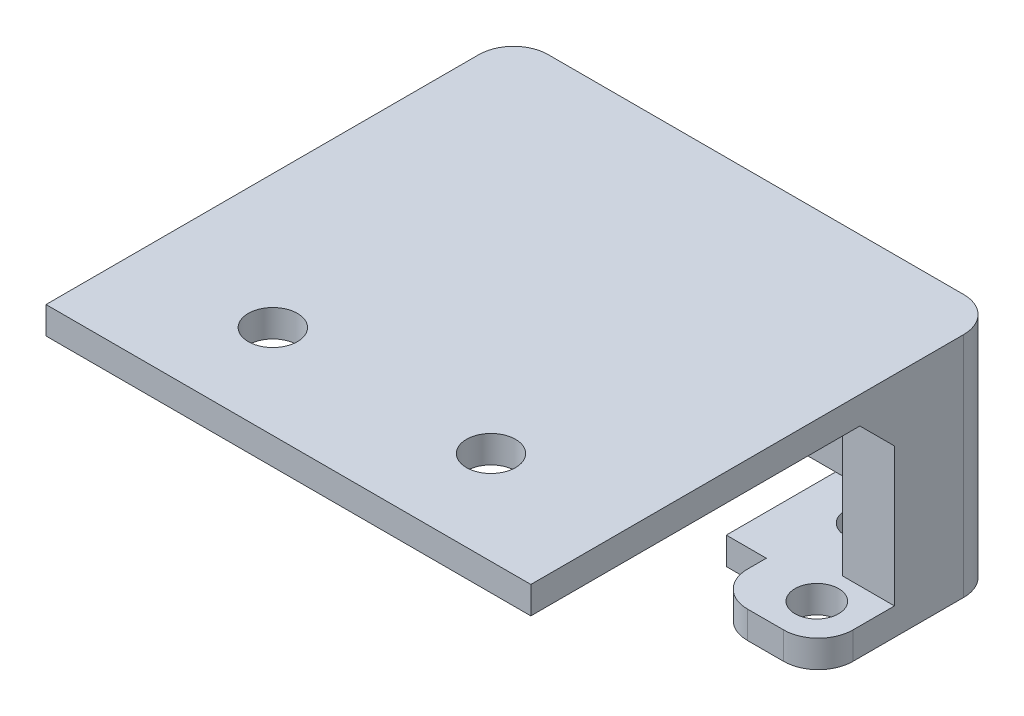
from build123d import *

# Parameters (mm, degrees)
SKETCH2_R             = 1.6
BOSS_EXTRUDE1_DEPTH   = 2
BOSS_EXTRUDE1_2_DEPTH = 2
BOSS_EXTRUDE2_DEPTH   = 12.7
SKETCH4_R             = 1.8
BOSS_EXTRUDE3_DEPTH   = 2
CHAMFER1_SIZE         = 2.54


with BuildPart() as part:
    # Sketch2 → Boss-Extrude1 (new body)
    with BuildSketch(Plane(origin=(0, 84.355025863, 0), x_dir=(1, 0, 0), z_dir=(0, 1, 0))):
        with BuildLine():
            Line((86.165130669, -169.940155685), (88.815130669, -169.940155685))
            ThreePointArc((88.815130669, -169.940155685), (90.611181893, -169.196206909), (91.355130669, -167.400155685))
            Line((91.355130669, -167.400155685), (91.355130669, -166.020155685))
            Line((91.355130669, -166.020155685), (94.293130669, -166.020155685))
            Line((94.293130669, -166.020155685), (94.293130669, -163.082155685))
            Line((94.293130669, -163.082155685), (94.293130669, -156.732155685))
            Line((94.293130669, -156.732155685), (86.165130669, -156.732155685))
            ThreePointArc((86.165130669, -156.732155685), (84.369079444, -157.47610446), (83.625130669, -159.272155685))
            Line((83.625130669, -159.272155685), (83.625130669, -167.400155685))
            ThreePointArc((83.625130669, -167.400155685), (84.369079444, -169.196206909), (86.165130669, -169.940155685))
        make_face()
        with Locations(Location((86.773356517, -166.898975693, 0), (0, 0, 270))):
            Circle(SKETCH2_R, mode=Mode.SUBTRACT)
        with Locations(Location((89.895511725, -160.090079663, 0), (0, 0, 270))):
            Circle(SKETCH2_R, mode=Mode.SUBTRACT)
    extrude(amount=BOSS_EXTRUDE1_DEPTH)



with BuildPart() as body_2:
    # Sketch2 → Boss-Extrude1 2 (new body)
    with BuildSketch(Plane(origin=(0, 84.355025863, 0), x_dir=(1, 0, 0), z_dir=(0, 1, 0))):
        with BuildLine():
            Line((113.995130669, -169.940155685), (116.645130669, -169.940155685))
            ThreePointArc((116.645130669, -169.940155685), (118.441181893, -169.196206909), (119.185130669, -167.400155685))
            Line((119.185130669, -167.400155685), (119.185130669, -159.272155685))
            ThreePointArc((119.185130669, -159.272155685), (118.441181893, -157.47610446), (116.645130669, -156.732155685))
            Line((116.645130669, -156.732155685), (108.517130669, -156.732155685))
            Line((108.517130669, -156.732155685), (108.517130669, -163.082155685))
            Line((108.517130669, -163.082155685), (108.517130669, -166.020155685))
            Line((108.517130669, -166.020155685), (111.455130669, -166.020155685))
            Line((111.455130669, -166.020155685), (111.455130669, -167.400155685))
            ThreePointArc((111.455130669, -167.400155685), (112.199079444, -169.196206909), (113.995130669, -169.940155685))
        make_face()
        with Locations(Location((116.03690482, -166.898975693, 0), (0, 0, 270))):
            Circle(SKETCH2_R, mode=Mode.SUBTRACT)
        with Locations(Location((112.914749612, -160.090079663, 0), (0, 0, 270))):
            Circle(SKETCH2_R, mode=Mode.SUBTRACT)
    extrude(amount=BOSS_EXTRUDE1_2_DEPTH)


with BuildPart() as part_1:
    add(part.part)

    add(body_2.part)  # Boss-Extrude2 merges body 2
    # Sketch3 → Boss-Extrude2 (add)
    with BuildSketch(Plane(origin=(0, 86.355025863, 0), x_dir=(1, 0, 0), z_dir=(0, 1, 0))):
        with BuildLine():
            Line((108.517130669, -158.002155685), (108.517130669, -156.732155685))
            Line((108.517130669, -156.732155685), (94.293130669, -156.732155685))
            Line((94.293130669, -156.732155685), (86.165130669, -156.732155685))
            ThreePointArc((86.165130669, -156.732155685), (84.369079444, -157.47610446), (83.625130669, -159.272155685))
            Line((83.625130669, -159.272155685), (83.625130669, -164.352155685))
            Line((83.625130669, -164.352155685), (87.435130669, -164.352155685))
            Line((87.435130669, -164.352155685), (87.435130669, -158.002155685))
            Line((87.435130669, -158.002155685), (108.517130669, -158.002155685))
        make_face()
        with BuildLine():
            Line((115.375130669, -164.352155685), (119.185130669, -164.352155685))
            Line((119.185130669, -164.352155685), (119.185130669, -159.272155685))
            ThreePointArc((119.185130669, -159.272155685), (118.441181893, -157.47610446), (116.645130669, -156.732155685))
            Line((116.645130669, -156.732155685), (108.517130669, -156.732155685))
            Line((108.517130669, -156.732155685), (108.517130669, -158.002155685))
            Line((108.517130669, -158.002155685), (115.375130669, -158.002155685))
            Line((115.375130669, -158.002155685), (115.375130669, -164.352155685))
        make_face()
    extrude(amount=BOSS_EXTRUDE2_DEPTH)

    # Sketch4 → Boss-Extrude3 (add)
    with BuildSketch(Plane(origin=(0, 99.055025863, 0), x_dir=(1, 0, 0), z_dir=(0, 1, 0))):
        with BuildLine():
            Line((83.625130669, -164.352155685), (83.625130669, -191.022155685))
            Line((83.625130669, -191.022155685), (119.185130669, -191.022155685))
            Line((119.185130669, -191.022155685), (119.185130669, -164.352155685))
            Line((119.185130669, -164.352155685), (119.185130669, -159.272155685))
            ThreePointArc((119.185130669, -159.272155685), (118.441181893, -157.47610446), (116.645130669, -156.732155685))
            Line((116.645130669, -156.732155685), (86.165130669, -156.732155685))
            ThreePointArc((86.165130669, -156.732155685), (84.369079444, -157.47610446), (83.625130669, -159.272155685))
            Line((83.625130669, -159.272155685), (83.625130669, -164.352155685))
        make_face()
        with Locations(Location((93.405130669, -184.164155685, 0), (0, 0, 270))):
            Circle(SKETCH4_R, mode=Mode.SUBTRACT)
        with Locations(Location((109.405130669, -184.164155685, 0), (0, 0, 270))):
            Circle(SKETCH4_R, mode=Mode.SUBTRACT)
    extrude(amount=BOSS_EXTRUDE3_DEPTH)

    # Chamfer1
    chamfer1_edges = [part_1.edges().sort_by_distance(p)[0] for p in [
        (85.530130669, 99.055025863, 164.352155685),
        (87.435130669, 99.055025863, 161.177155685),
        (101.405130669, 99.055025863, 158.002155685),
        (115.375130669, 99.055025863, 161.177155685),
        (117.280130669, 99.055025863, 164.352155685),
    ]]
    chamfer(chamfer1_edges, length=CHAMFER1_SIZE)


solid = part_1.part
